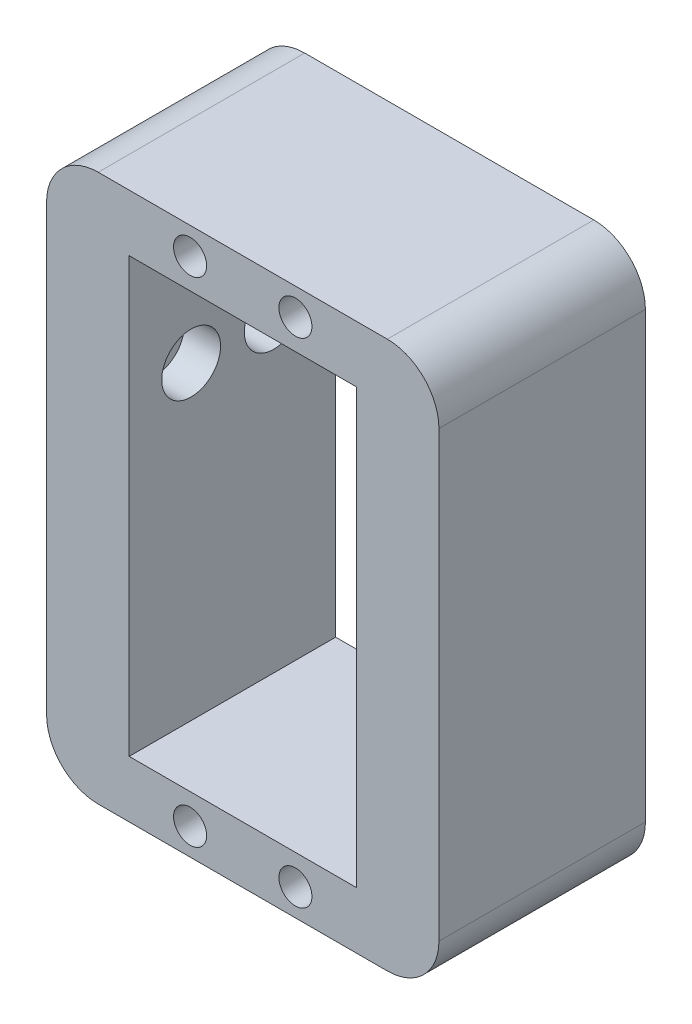
from build123d import *

# Parameters (mm, degrees)
SKETCH1_W           = 38
SKETCH1_H           = 53
SKETCH1_W_2         = 22
SKETCH1_H_2         = 42
BOSS_EXTRUDE1_DEPTH = 20
SKETCH4_R           = 1.6
CUT_EXTRUDE3_DEPTH  = 39.252450902
FILLET1_R           = 5
SKETCH5_R           = 1.75
CUT_EXTRUDE4_DEPTH  = 45.746508244
SKETCH5_4_R         = 2.85
SKETCH5_4_R_2       = 1.75
CUT_EXTRUDE6_DEPTH  = 3.5


with BuildPart() as part:
    # Sketch1 → Boss-Extrude1 (new body)
    with BuildSketch(Plane.XY):
        Rectangle(SKETCH1_W, SKETCH1_H)
        Rectangle(SKETCH1_W_2, SKETCH1_H_2, mode=Mode.SUBTRACT)
    extrude(amount=BOSS_EXTRUDE1_DEPTH)

    # Sketch4 → Cut-Extrude3 (cut, through all)
    with BuildSketch(Plane(origin=(0, 0, 0), x_dir=(-1, 0, 0), z_dir=(0, 0, -1))):
        with Locations((-5.1, -23.9)):
            Circle(SKETCH4_R)
        with Locations((5.1, -23.9)):
            Circle(SKETCH4_R)
        with Locations((-5.1, 23.9)):
            Circle(SKETCH4_R)
        with Locations((5.1, 23.9)):
            Circle(SKETCH4_R)
    extrude(amount=-CUT_EXTRUDE3_DEPTH, mode=Mode.SUBTRACT)

    # Fillet1
    fillet1_edges = [part.edges().sort_by_distance(p)[0] for p in [
        (-19, -26.5, 10),
        (19, -26.5, 10),
        (-19, 26.5, 10),
        (19, 26.5, 10),
    ]]
    fillet(fillet1_edges, radius=FILLET1_R)

    # Sketch5 → Cut-Extrude4 (cut, through all)
    with BuildSketch(Plane(origin=(-11, 0, 0), x_dir=(0, 0, -1), z_dir=(1, 0, 0))):
        with Locations((-14, 9)):
            Circle(SKETCH5_R)
        with Locations((-6, 9)):
            Circle(SKETCH5_R)
    extrude(amount=-CUT_EXTRUDE4_DEPTH, mode=Mode.SUBTRACT)

    # Sketch5<4> → Cut-Extrude6 (cut)
    # profile 1 of 2: a face of its own
    with BuildSketch(Plane(origin=(-11, 0, 0), x_dir=(0, 0, -1), z_dir=(1, 0, 0))):
        with Locations((-14, 9)):
            Circle(SKETCH5_4_R)
        with Locations((-14, 9)):
            Circle(SKETCH5_4_R_2, mode=Mode.SUBTRACT)
    # profile 2 of 2: a face of its own
    with BuildSketch(Plane(origin=(-11, 0, 0), x_dir=(0, 0, -1), z_dir=(1, 0, 0))):
        with Locations((-6, 9)):
            Circle(SKETCH5_4_R)
        with Locations((-6, 9)):
            Circle(SKETCH5_4_R_2, mode=Mode.SUBTRACT)
    extrude(amount=-CUT_EXTRUDE6_DEPTH, mode=Mode.SUBTRACT)


solid = part.part
